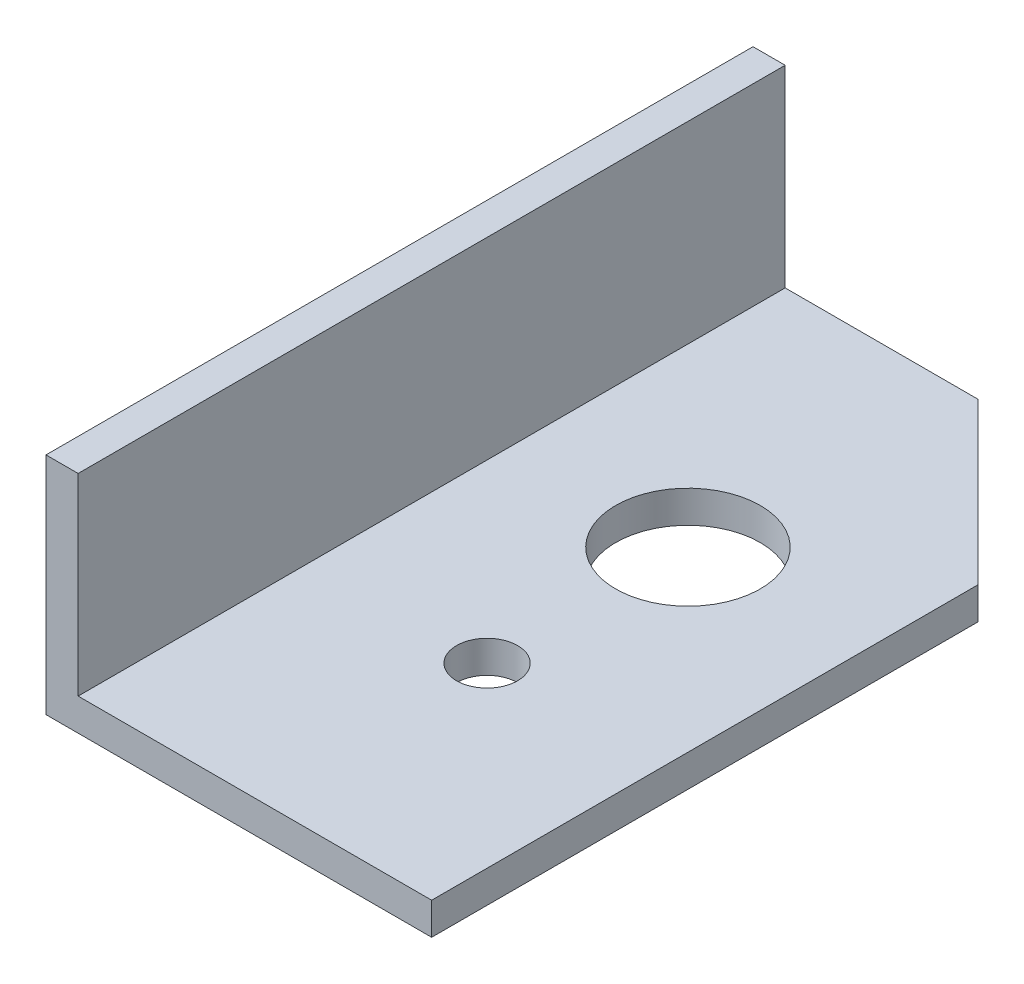
from build123d import *

# Parameters (mm, degrees)
EXTRUDE_1_DEPTH     = 44
CHAMFER_1_SIZE      = 10
SKETCH_4_R          = 4.5
SKETCH_4_R_2        = 1.9
CUT_EXTRUDE_1_DEPTH = 52.536394907


with BuildPart() as part:
    # Эскиз2 → Вытянуть-Тонкостенный1 (new body)
    with BuildSketch(Plane.XY):
        Polygon((24, 0), (0, 0), (0, 14), (2, 14), (2, 2), (24, 2), align=None)
    extrude(amount=EXTRUDE_1_DEPTH)

    # Фаска1
    chamfer_1_edges = [part.edges().sort_by_distance(p)[0] for p in [
        (24, 1, 0),
    ]]
    chamfer(chamfer_1_edges, length=CHAMFER_1_SIZE)

    # Эскиз4 → Вырез-Вытянуть1 (cut, through all)
    with BuildSketch(Plane(origin=(0, 2, 0), x_dir=(-1, 0, 0), z_dir=(0, 1, 0))):
        with Locations(Location((-12.95, 17, 0), (0, 0, 270))):
            Circle(SKETCH_4_R)
        with Locations(Location((-12.95, 29.5, 0), (0, 0, 270))):
            Circle(SKETCH_4_R_2)
    extrude(amount=-CUT_EXTRUDE_1_DEPTH, mode=Mode.SUBTRACT)


solid = part.part
